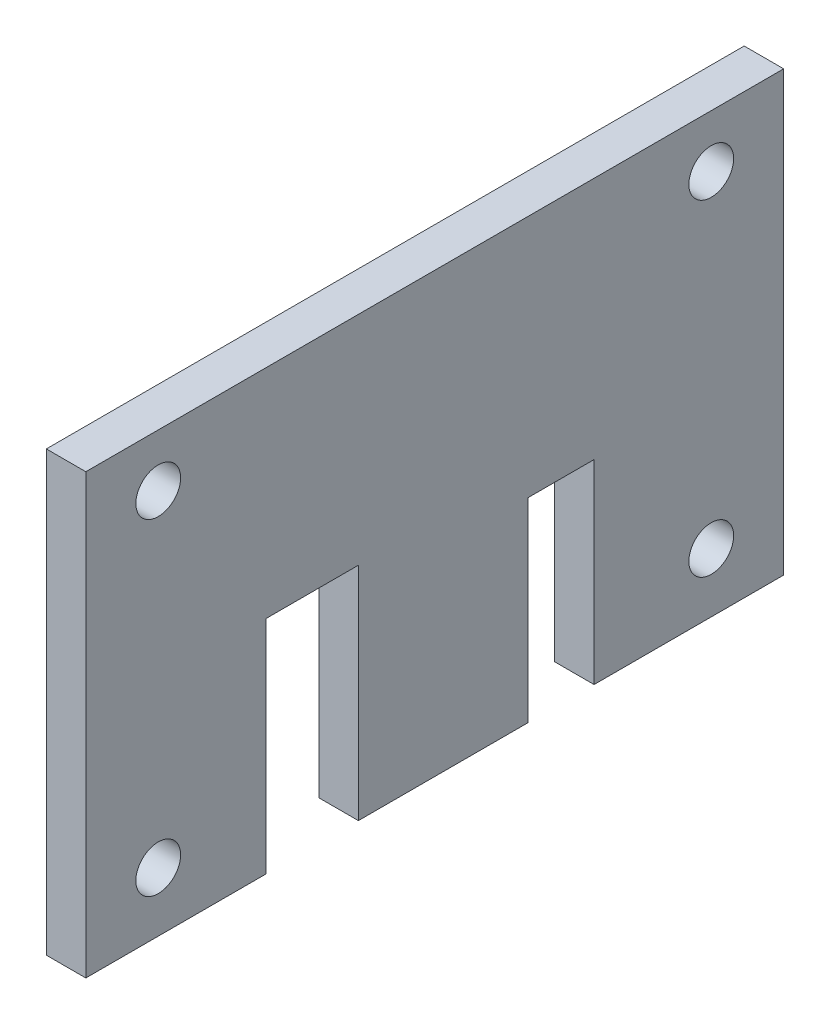
from build123d import *

# Parameters (mm, degrees)
SKETCH1_W           = 53
SKETCH1_H           = 33.3
COVER_PLATE_DEPTH   = 3
SKETCH2_W           = 7
SKETCH2_H           = 17.8
SKETCH2_W_2         = 5
SKETCH2_H_2         = 15.8
CABLE_NOTCHES_DEPTH = 5
SKETCH3_R           = 1.7
SCREW_HOLES_DEPTH   = 5


with BuildPart() as part:
    # Sketch1 → Cover Plate (new body)
    with BuildSketch(Plane(origin=(72.4, 0, 0), x_dir=(0, 0, -1), z_dir=(1, 0, 0))):
        with Locations((-73, -10.15)):
            Rectangle(SKETCH1_W, SKETCH1_H)
    extrude(amount=COVER_PLATE_DEPTH)

    # Sketch2 → Cable Notches (cut)
    with BuildSketch(Plane(origin=(71.4, 0, 0), x_dir=(0, 0, -1), z_dir=(1, 0, 0))):
        with Locations((-82.3, -18.9)):
            Rectangle(SKETCH2_W, SKETCH2_H)
        with Locations((-63.4, -19.9)):
            Rectangle(SKETCH2_W_2, SKETCH2_H_2)
    extrude(amount=CABLE_NOTCHES_DEPTH, mode=Mode.SUBTRACT)

    # Sketch3 → Screw Holes (cut)
    with BuildSketch(Plane(origin=(71.4, 0, 0), x_dir=(0, 0, -1), z_dir=(1, 0, 0))):
        with Locations((-94, -22.3)):
            Circle(SKETCH3_R)
        with Locations((-94, 2.5)):
            Circle(SKETCH3_R)
        with Locations((-52, -22.3)):
            Circle(SKETCH3_R)
        with Locations((-52, 2.5)):
            Circle(SKETCH3_R)
    extrude(amount=SCREW_HOLES_DEPTH, mode=Mode.SUBTRACT)


solid = part.part
